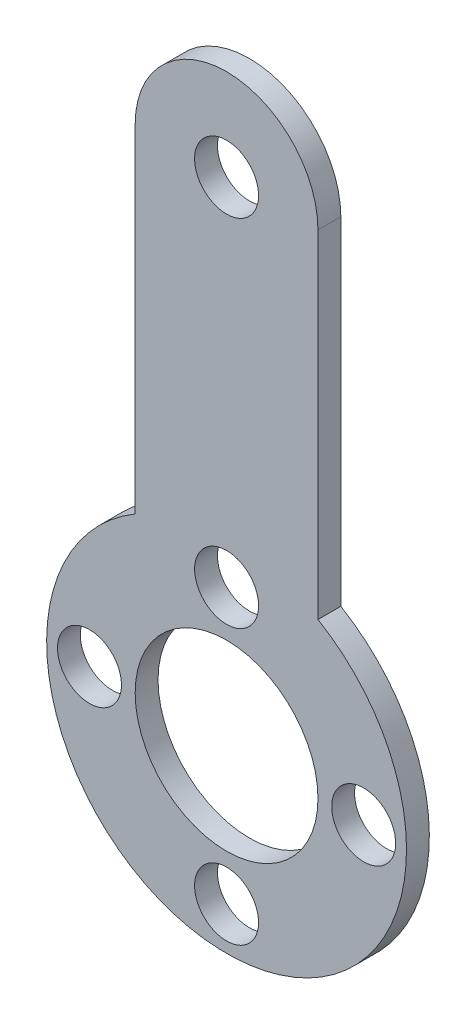
from build123d import *

# Parameters (mm, degrees)
SKETCH1_R           = 1.778
SKETCH1_R_2         = 5.08
BOSS_EXTRUDE1_DEPTH = 1.27


with BuildPart() as part:
    # Sketch1 → Boss-Extrude1 (new body)
    with BuildSketch(Plane.XY):
        with BuildLine():
            Line((5.343552637, -2.608214098), (5.343552637, 16.141784786))
            ThreePointArc((5.343552637, 16.141784786), (0.263552637, 21.221784786), (-4.816447363, 16.141784786))
            Line((-4.816447363, 16.141784786), (-4.816447363, -2.608214098))
            ThreePointArc((-4.816447363, -2.608214098), (0.263552637, -21.221784786), (5.343552637, -2.608214098))
        make_face()
        with Locations((0.263552637, -3.601784786)):
            Circle(SKETCH1_R, mode=Mode.SUBTRACT)
        with Locations((-7.356447363, -11.221784786)):
            Circle(SKETCH1_R, mode=Mode.SUBTRACT)
        with Locations((7.883552637, -11.221784786)):
            Circle(SKETCH1_R, mode=Mode.SUBTRACT)
        with Locations((0.263552637, -18.841784786)):
            Circle(SKETCH1_R, mode=Mode.SUBTRACT)
        with Locations((0.263552637, -11.221784786)):
            Circle(SKETCH1_R_2, mode=Mode.SUBTRACT)
        with Locations((0.263552637, 16.141784786)):
            Circle(SKETCH1_R, mode=Mode.SUBTRACT)
    extrude(amount=BOSS_EXTRUDE1_DEPTH)


solid = part.part
